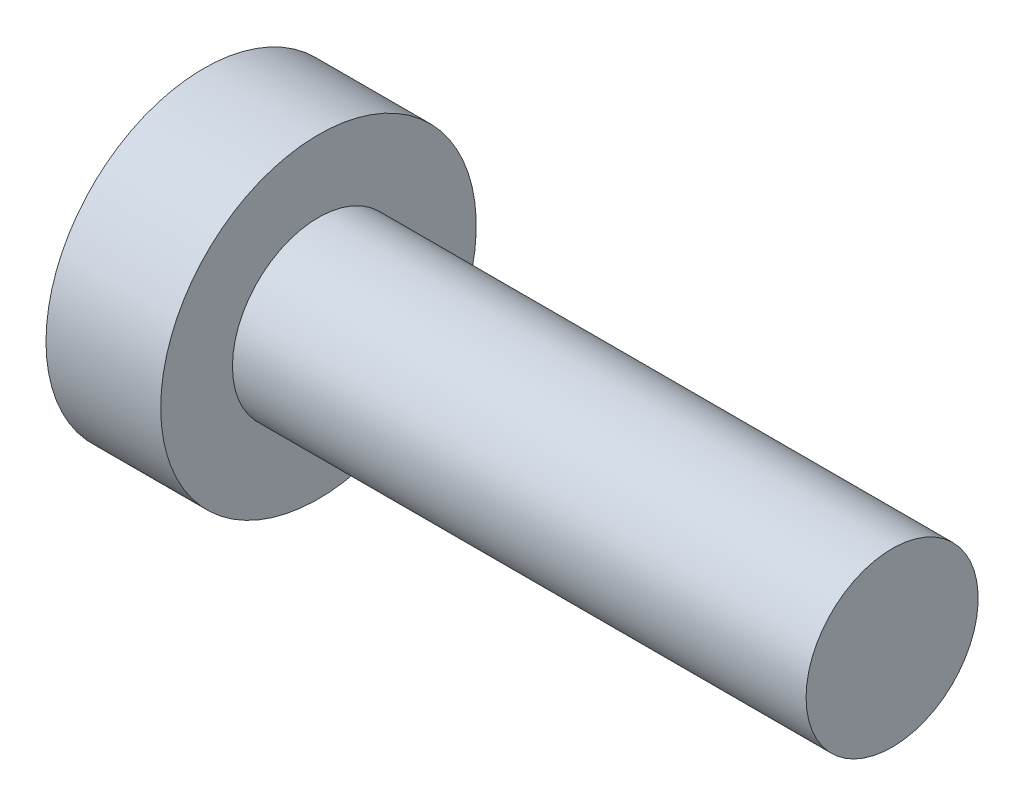
from build123d import *

# Parameters (mm, degrees)
CUT_EXTRUDE1_DEPTH = 1.5


with BuildPart() as part:
    # Sketch1 → Revolve1 (revolve)
    with BuildSketch(Plane.XY, mode=Mode.PRIVATE) as revolve1_sk:
        Polygon((-2, 0), (-2, 2.75), (0, 2.75), (0, 1.5), (10, 1.5), (10, 0), align=None)
    revolve(revolve1_sk.sketch.rotate(Axis((-22.358139419, 0, 0), (1, 0, 0)), 90), axis=Axis((-22.358139419, 0, 0), (1, 0, 0)))

    # Sketch2 → Cut-Revolve1 (revolve, cut)
    with BuildSketch(Plane(origin=(0, 0, 0), x_dir=(1, 0, 0), z_dir=(0, 1, 0)), mode=Mode.PRIVATE) as cut_revolve1_sk:
        Polygon((-2, 1.25), (-2, 0), (0.221687836, 0), (-0.5, 1.25), align=None)
    revolve(cut_revolve1_sk.sketch.rotate(Axis((-5.673571921, 0, 0), (1, 0, 0)), 180), axis=Axis((-5.673571921, 0, 0), (1, 0, 0)), mode=Mode.SUBTRACT)

    # Sketch3 → Cut-Extrude1 (cut)
    with BuildSketch(Plane.ZY.offset(2)):
        Polygon((0, 1.443375673), (-1.25, 0.721687836), (-1.25, -0.721687836), (0, -1.443375673), (1.25, -0.721687836), (1.25, 0.721687836), align=None)
    extrude(amount=-CUT_EXTRUDE1_DEPTH, mode=Mode.SUBTRACT)


solid = part.part
